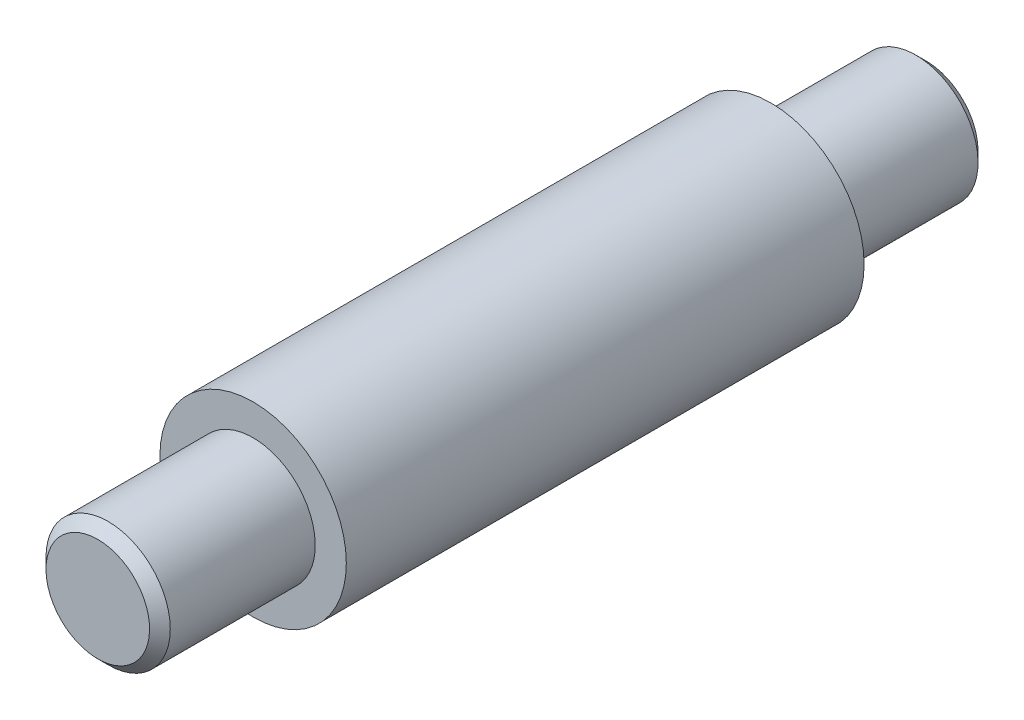
from build123d import *

# Parameters (mm, degrees)
CHAMFER1_SIZE = 1


with BuildPart() as part:
    # Sketch1 → Revolve1 (revolve)
    with BuildSketch(Plane(origin=(0, 0, 0), x_dir=(0, 0, -1), z_dir=(1, 0, 0)), mode=Mode.PRIVATE) as revolve1_sk:
        Polygon((-25, 0), (25, 0), (40, 0), (40, 6), (25, 6), (25, 9), (-25, 9), (-25, 6), (-40, 6), (-40, 0), align=None)
    revolve(revolve1_sk.sketch.rotate(Axis((0, 0, 25), (0, 0, -1)), 180), axis=Axis((0, 0, 25), (0, 0, -1)))

    # Chamfer1
    chamfer1_edges = [part.edges().sort_by_distance(p)[0] for p in [
        (0, 6, -40),
        (0, 6, 40),
    ]]
    chamfer(chamfer1_edges, length=CHAMFER1_SIZE)


solid = part.part
